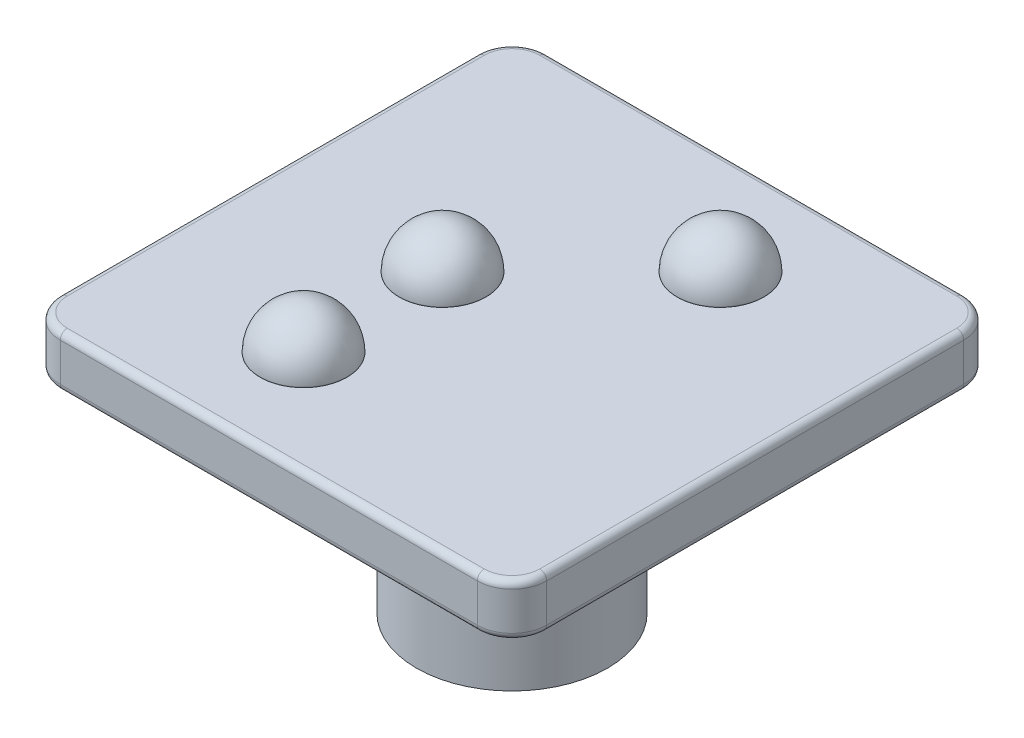
from build123d import *

# Parameters (mm, degrees)
BOSS_EXTRUDE1_DEPTH = 1.5
SKETCH2_R           = 2.75
BOSS_EXTRUDE2_DEPTH = 6
SKETCH3_W           = 1.1
SKETCH3_H           = 1.45
SKETCH3_W_2         = 1.45
SKETCH3_H_2         = 1.1
CUT_EXTRUDE1_DEPTH  = 6
CHAMFER1_SIZE       = 0.3
FILLET1_R           = 1
SKETCH4_R           = 1.25
BOSS_EXTRUDE3_DEPTH = 0.01
DOME2_FACE_RADIUS   = 1.25
DOME2_HEIGHT        = 1.25
DOME3_FACE_RADIUS   = 1.25
DOME3_HEIGHT        = 1.25
DOME5_FACE_RADIUS   = 1.25
DOME5_HEIGHT        = 1.25
FILLET3_R           = 0.2


with BuildPart() as part:
    # Sketch1 → Boss-Extrude1 (new body)
    with BuildSketch(Plane(origin=(0, 0, 0), x_dir=(1, 0, 0), z_dir=(0, 1, 0))):
        with BuildLine():
            Line((-7.324675649, 4.396717546), (4.675324351, 4.396717546))
            ThreePointArc((4.675324351, 4.396717546), (5.382431132, 4.103824327), (5.675324351, 3.396717546))
            Line((5.675324351, 3.396717546), (5.675324351, -8.603282454))
            ThreePointArc((5.675324351, -8.603282454), (5.382431132, -9.310389235), (4.675324351, -9.603282454))
            Line((4.675324351, -9.603282454), (-7.324675649, -9.603282454))
            ThreePointArc((-7.324675649, -9.603282454), (-8.03178243, -9.310389235), (-8.324675649, -8.603282454))
            Line((-8.324675649, -8.603282454), (-8.324675649, 3.396717546))
            ThreePointArc((-8.324675649, 3.396717546), (-8.03178243, 4.103824327), (-7.324675649, 4.396717546))
        make_face()
    extrude(amount=BOSS_EXTRUDE1_DEPTH)

    # Sketch2 → Boss-Extrude2 (add)
    with BuildSketch(Plane.XZ):
        with Locations(Location((-1.324675649, 2.603282454, 0), (0, 0, 270))):
            Circle(SKETCH2_R)
    extrude(amount=BOSS_EXTRUDE2_DEPTH)

    # Sketch3 → Cut-Extrude1 (cut)
    with BuildSketch(Plane.XZ.offset(6)):
        with Locations((-1.324675649, 3.878282454)):
            Rectangle(SKETCH3_W, SKETCH3_H)
        with Locations((-0.049675649, 2.603282454)):
            Rectangle(SKETCH3_W_2, SKETCH3_H_2)
        with Locations((-1.324675649, 2.603282454)):
            Rectangle(SKETCH3_W, SKETCH3_H_2)
        with Locations((-2.599675649, 2.603282454)):
            Rectangle(SKETCH3_W_2, SKETCH3_H_2)
        with Locations((-1.324675649, 1.328282454)):
            Rectangle(SKETCH3_W, SKETCH3_H)
    extrude(amount=-CUT_EXTRUDE1_DEPTH, mode=Mode.SUBTRACT)

    # Chamfer1
    chamfer1_edges = [part.edges().sort_by_distance(p)[0] for p in [
        (-0.774675649, -6, 3.878282454),
        (-0.049675649, -6, 3.153282454),
        (0.675324351, -6, 2.603282454),
        (-0.774675649, -6, 1.328282454),
        (-2.599675649, -6, 3.153282454),
        (-1.324675649, -6, 4.603282454),
        (-1.874675649, -6, 3.878282454),
        (-3.324675649, -6, 2.603282454),
        (-2.599675649, -6, 2.053282454),
        (-1.874675649, -6, 1.328282454),
        (-1.324675649, -6, 0.603282454),
        (-0.049675649, -6, 2.053282454),
    ]]
    chamfer(chamfer1_edges, length=CHAMFER1_SIZE)

    # Fillet1
    fillet1_edges = [part.edges().sort_by_distance(p)[0] for p in [
        (-1.324675649, 0, 5.353282454),
    ]]
    fillet(fillet1_edges, radius=FILLET1_R)

    # Sketch4 → Boss-Extrude3 (add)
    with BuildSketch(Plane(origin=(0, 1.5, 0), x_dir=(1, 0, 0), z_dir=(0, 1, 0))):
        with Locations(Location((-3.324675649, -2.603282454, 0), (0, 0, 90))):
            Circle(SKETCH4_R)
        with Locations(Location((-3.324675649, -6.603282454, 0), (0, 0, 90))):
            Circle(SKETCH4_R)
        with Locations(Location((0.675324351, 1.396717546, 0), (0, 0, 90))):
            Circle(SKETCH4_R)
    extrude(amount=BOSS_EXTRUDE3_DEPTH)

    # Dome2: a dome of height H over a round flat face of radius A is a cap of a sphere of radius (A * A + H * H) / (2 * H)
    dome2_r = (DOME2_FACE_RADIUS * DOME2_FACE_RADIUS + DOME2_HEIGHT * DOME2_HEIGHT) / (2 * DOME2_HEIGHT)
    dome2_base = Plane((0.675324351, 1.51, -1.396717546), z_dir=(0, 1, 0))
    with Locations(dome2_base.offset(DOME2_HEIGHT - dome2_r)):
        dome2_ball = Sphere(dome2_r, mode=Mode.PRIVATE)
    add(split(dome2_ball, bisect_by=dome2_base, keep=Keep.TOP, mode=Mode.PRIVATE))

    # Dome3: a dome of height H over a round flat face of radius A is a cap of a sphere of radius (A * A + H * H) / (2 * H)
    dome3_r = (DOME3_FACE_RADIUS * DOME3_FACE_RADIUS + DOME3_HEIGHT * DOME3_HEIGHT) / (2 * DOME3_HEIGHT)
    dome3_base = Plane((-3.324675649, 1.51, 2.603282454), z_dir=(0, 1, 0))
    with Locations(dome3_base.offset(DOME3_HEIGHT - dome3_r)):
        dome3_ball = Sphere(dome3_r, mode=Mode.PRIVATE)
    add(split(dome3_ball, bisect_by=dome3_base, keep=Keep.TOP, mode=Mode.PRIVATE))

    # Dome5: a dome of height H over a round flat face of radius A is a cap of a sphere of radius (A * A + H * H) / (2 * H)
    dome5_r = (DOME5_FACE_RADIUS * DOME5_FACE_RADIUS + DOME5_HEIGHT * DOME5_HEIGHT) / (2 * DOME5_HEIGHT)
    dome5_base = Plane((-3.324675649, 1.51, 6.603282454), z_dir=(0, 1, 0))
    with Locations(dome5_base.offset(DOME5_HEIGHT - dome5_r)):
        dome5_ball = Sphere(dome5_r, mode=Mode.PRIVATE)
    add(split(dome5_ball, bisect_by=dome5_base, keep=Keep.TOP, mode=Mode.PRIVATE))

    # Fillet3
    fillet3_edges = [part.edges().sort_by_distance(p)[0] for p in [
        (5.382431132, 1.5, 9.310389235),
        (-1.324675649, 0, 9.603282454),
        (-8.03178243, 0, 9.310389235),
        (5.675324351, 1.5, 2.603282454),
        (5.382431132, 1.5, -4.103824327),
        (-1.324675649, 1.5, -4.396717546),
        (-8.03178243, 1.5, -4.103824327),
        (-8.324675649, 1.5, 2.603282454),
        (-8.03178243, 1.5, 9.310389235),
        (-1.324675649, 1.5, 9.603282454),
        (-8.324675649, 0, 2.603282454),
        (-8.03178243, 0, -4.103824327),
        (-1.324675649, 0, -4.396717546),
        (5.382431132, 0, -4.103824327),
        (5.675324351, 0, 2.603282454),
        (5.382431132, 0, 9.310389235),
    ]]
    fillet(fillet3_edges, radius=FILLET3_R)


solid = part.part
